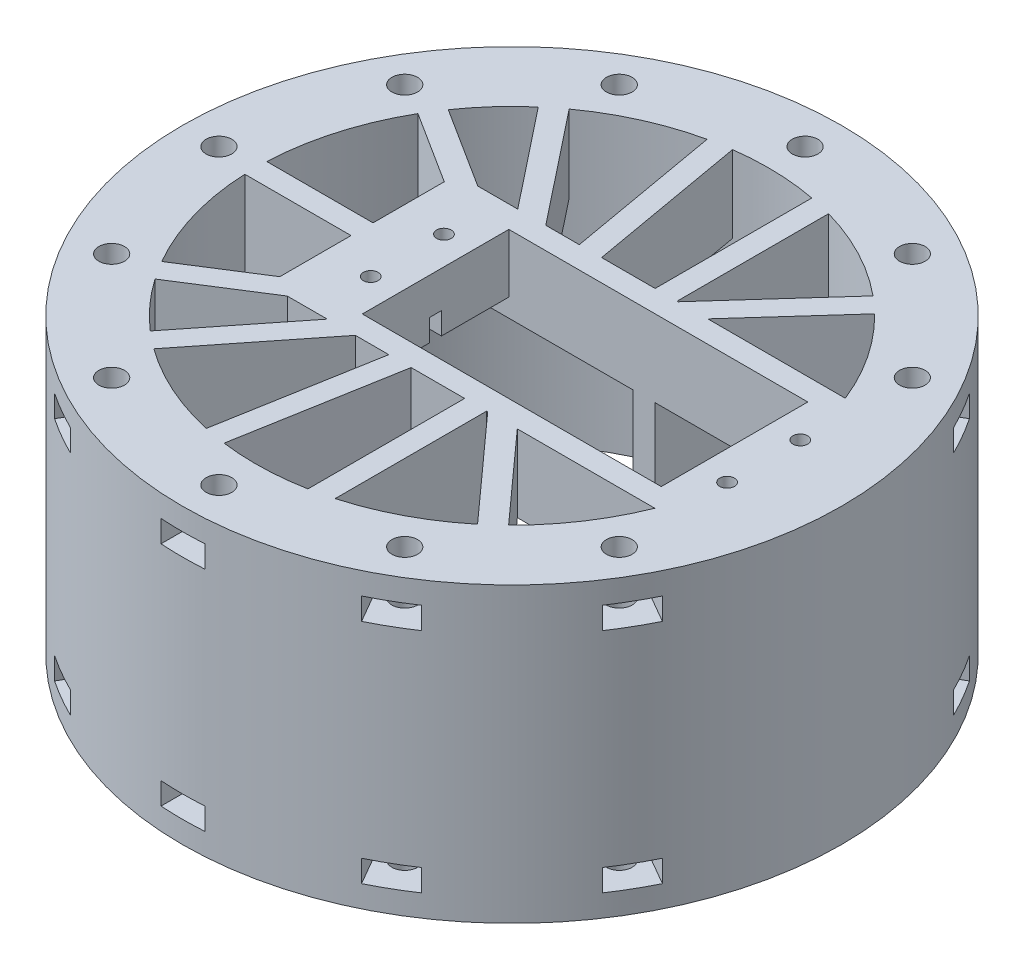
from build123d import *
from build123d.topology import SkipClean

# Parameters (mm, degrees)
SKETCH1_R                      = 45
BOSS_EXTRUDE1_DEPTH            = 40
SKETCH2_R                      = 35
CUT_EXTRUDE1_DEPTH             = 29.5
SKETCH3_W                      = 55
SKETCH3_H                      = 20
CUT_EXTRUDE2_DEPTH             = 2.5
CUT_EXTRUDE2_DIRECTION_2_REACH = 72.144
SKETCH4_W                      = 40.8
SKETCH4_H                      = 20
CUT_EXTRUDE3_DEPTH             = 9
BOSS_EXTRUDE2_DEPTH            = 29.5
SKETCH16_W                     = 7.160198966
SKETCH16_H                     = 1.6
SKETCH16_W_2                   = 7.039801034
CUT_EXTRUDE10_DEPTH            = 3
SKETCH27_R                     = 1.75
CUT_EXTRUDE15_DEPTH            = 76.166481892
CUT_EXTRUDE17_START            = -3
CUT_EXTRUDE17_DEPTH            = 3
SKETCH32_R                     = 1
CUT_EXTRUDE21_DEPTH            = 72.232015274
CUT_EXTRUDE22_DEPTH            = 12
CUT_EXTRUDE23_REACH            = 78.074
CUT_EXTRUDE24_DEPTH            = 3


with BuildPart() as part:
    # Sketch1 → Boss-Extrude1 (new body)
    with BuildSketch(Plane(origin=(0, 0, 0), x_dir=(1, 0, 0), z_dir=(0, 1, 0))):
        with Locations(Location((0, 0, 0), (0, 0, 270))):
            Circle(SKETCH1_R)
    extrude(amount=BOSS_EXTRUDE1_DEPTH)

    # Sketch2 → Cut-Extrude1 (cut)
    with BuildSketch(Plane.XZ):
        with Locations(Location((0, 0, 0), (0, 0, 270))):
            Circle(SKETCH2_R)
    extrude(amount=-CUT_EXTRUDE1_DEPTH, mode=Mode.SUBTRACT)

    # Sketch3 → Cut-Extrude2 (cut)
    with BuildSketch(Plane.XZ.offset(-29.5)):
        with Locations((10.032407403, 0)):
            Rectangle(SKETCH3_W, SKETCH3_H)
    extrude(amount=-CUT_EXTRUDE2_DEPTH, mode=Mode.SUBTRACT)

    # Sketch3 → Cut-Extrude2 direction 2 (cut, up to next)
    with BuildSketch(Plane.XZ.offset(-29.5), mode=Mode.PRIVATE) as cut_extrude2_direction_2_sk1:
        with Locations((10.032407403, 0)):
            Rectangle(SKETCH3_W, SKETCH3_H)
    cut_extrude2_direction_2_tool1 = extrude(cut_extrude2_direction_2_sk1.sketch, amount=CUT_EXTRUDE2_DIRECTION_2_REACH, mode=Mode.PRIVATE) & part.part
    add(cut_extrude2_direction_2_tool1.solids().sort_by_distance((10.032407, 29.5, 0))[0], mode=Mode.SUBTRACT)

    # Sketch4 → Cut-Extrude3 (cut)
    with BuildSketch(Plane.XZ.offset(-32)):
        with Locations((9.972208437, 0)):
            Rectangle(SKETCH4_W, SKETCH4_H)
    extrude(amount=-CUT_EXTRUDE3_DEPTH, mode=Mode.SUBTRACT)

    # Sketch8 → Boss-Extrude2 (add, through all)
    with BuildSketch(Plane.XZ.offset(-29.5)):
        with BuildLine():
            Line((6.536713533, 10), (6.536713533, 34.384173339))
            ThreePointArc((6.536713533, 34.384173339), (8.317046002, 35.216938381), (9.536713533, 33.675675123))
            Line((9.536713533, 33.675675123), (9.536713533, 10))
            Line((9.536713533, 10), (6.536713533, 10))
        make_face()
        with BuildLine():
            Line((9.536713533, -10), (6.536713533, -10))
            Line((6.536713533, -10), (6.536713533, -34.384173339))
            ThreePointArc((6.536713533, -34.384173339), (8.317046002, -35.216938381), (9.536713533, -33.675675123))
            Line((9.536713533, -33.675675123), (9.536713533, -10))
        make_face()
        with BuildLine():
            Line((-17.467592597, 1.5), (-34.96784237, 1.5))
            ThreePointArc((-34.96784237, 1.5), (-36.46784237, 0), (-34.96784237, -1.5))
            Line((-34.96784237, -1.5), (-17.467592597, -1.5))
            Line((-17.467592597, -1.5), (-17.467592597, 1.5))
        make_face()
    extrude(amount=BOSS_EXTRUDE2_DEPTH)

    # Sketch16 → Cut-Extrude10 (cut)
    with BuildSketch(Plane.XZ.offset(-32)):
        with Locations((33.95230792, 0)):
            Rectangle(SKETCH16_W, SKETCH16_H)
        with Locations((-13.94769208, 0)):
            Rectangle(SKETCH16_W_2, SKETCH16_H)
    extrude(amount=-CUT_EXTRUDE10_DEPTH, mode=Mode.SUBTRACT)

    # Sketch27 → Cut-Extrude15 (cut, through all)
    with BuildSketch(Plane.XZ):
        with Locations(Location((34.641016151, -20, 0), (0, 0, 270))):
            Circle(SKETCH27_R)
        with Locations(Location((20, -34.641016151, 0), (0, 0, 270))):
            Circle(SKETCH27_R)
        with Locations(Location((0, -40, 0), (0, 0, 270))):
            Circle(SKETCH27_R)
        with Locations(Location((-20, -34.641016151, 0), (0, 0, 270))):
            Circle(SKETCH27_R)
        with Locations(Location((-34.641016151, -20, 0), (0, 0, 270))):
            Circle(SKETCH27_R)
        with Locations(Location((-40, 0, 0), (0, 0, 270))):
            Circle(SKETCH27_R)
        with Locations(Location((-34.641016151, 20, 0), (0, 0, 270))):
            Circle(SKETCH27_R)
        with Locations(Location((-20, 34.641016151, 0), (0, 0, 270))):
            Circle(SKETCH27_R)
        with Locations(Location((0, 40, 0), (0, 0, 270))):
            Circle(SKETCH27_R)
        with Locations(Location((20, 34.641016151, 0), (0, 0, 270))):
            Circle(SKETCH27_R)
        with Locations(Location((34.641016151, 20, 0), (0, 0, 270))):
            Circle(SKETCH27_R)
    extrude(amount=-CUT_EXTRUDE15_DEPTH, mode=Mode.SUBTRACT)

    # Sketch28 → Cut-Extrude17 (cut)
    with BuildSketch(Plane(origin=(0, 37, 0), x_dir=(1, 0, 0), z_dir=(0, 1, 0)).offset(CUT_EXTRUDE17_START)):
        with BuildLine():
            Line((-31.641016151, 18.267949192), (-31.641016151, 21.732050808))
            Line((-31.641016151, 21.732050808), (-37.38444419, 25.048020532))
            ThreePointArc((-37.38444419, 25.048020532), (-38.97114317, 22.5), (-40.38444419, 19.851868109))
            Line((-40.38444419, 19.851868109), (-34.641016151, 16.535898385))
            Line((-34.641016151, 16.535898385), (-31.641016151, 18.267949192))
        make_face()
        with BuildLine():
            Line((-36.535898385, 0), (-38.267949192, 3))
            Line((-38.267949192, 3), (-44.899888641, 3))
            ThreePointArc((-44.899888641, 3), (-45, 0), (-44.899888641, -3))
            Line((-44.899888641, -3), (-38.267949192, -3))
            Line((-38.267949192, -3), (-36.535898385, 0))
        make_face()
        with BuildLine():
            Line((-18.267949192, 31.641016151), (-16.535898385, 34.641016151))
            Line((-16.535898385, 34.641016151), (-19.851868109, 40.38444419))
            ThreePointArc((-19.851868109, 40.38444419), (-22.5, 38.97114317), (-25.048020532, 37.38444419))
            Line((-25.048020532, 37.38444419), (-21.732050808, 31.641016151))
            Line((-21.732050808, 31.641016151), (-18.267949192, 31.641016151))
        make_face()
        with BuildLine():
            Line((0, 36.535898385), (3, 38.267949192))
            Line((3, 38.267949192), (3, 44.899888641))
            ThreePointArc((3, 44.899888641), (0, 45), (-3, 44.899888641))
            Line((-3, 44.899888641), (-3, 38.267949192))
            Line((-3, 38.267949192), (0, 36.535898385))
        make_face()
        with BuildLine():
            Line((18.267949192, 31.641016151), (21.732050808, 31.641016151))
            Line((21.732050808, 31.641016151), (25.048020532, 37.38444419))
            ThreePointArc((25.048020532, 37.38444419), (22.5, 38.97114317), (19.851868109, 40.38444419))
            Line((19.851868109, 40.38444419), (16.535898385, 34.641016151))
            Line((16.535898385, 34.641016151), (18.267949192, 31.641016151))
        make_face()
        with BuildLine():
            Line((31.641016151, 18.267949192), (34.641016151, 16.535898385))
            Line((34.641016151, 16.535898385), (40.38444419, 19.851868109))
            ThreePointArc((40.38444419, 19.851868109), (38.97114317, 22.5), (37.38444419, 25.048020532))
            Line((37.38444419, 25.048020532), (31.641016151, 21.732050808))
            Line((31.641016151, 21.732050808), (31.641016151, 18.267949192))
        make_face()
        with BuildLine():
            Line((31.641016151, -18.267949192), (31.641016151, -21.732050808))
            Line((31.641016151, -21.732050808), (37.38444419, -25.048020532))
            ThreePointArc((37.38444419, -25.048020532), (38.97114317, -22.5), (40.38444419, -19.851868109))
            Line((40.38444419, -19.851868109), (34.641016151, -16.535898385))
            Line((34.641016151, -16.535898385), (31.641016151, -18.267949192))
        make_face()
        with BuildLine():
            Line((18.267949192, -31.641016151), (16.535898385, -34.641016151))
            Line((16.535898385, -34.641016151), (19.851868109, -40.38444419))
            ThreePointArc((19.851868109, -40.38444419), (22.5, -38.97114317), (25.048020532, -37.38444419))
            Line((25.048020532, -37.38444419), (21.732050808, -31.641016151))
            Line((21.732050808, -31.641016151), (18.267949192, -31.641016151))
        make_face()
        with BuildLine():
            Line((0, -36.535898385), (-3, -38.267949192))
            Line((-3, -38.267949192), (-3, -44.899888641))
            ThreePointArc((-3, -44.899888641), (0, -45), (3, -44.899888641))
            Line((3, -44.899888641), (3, -38.267949192))
            Line((3, -38.267949192), (0, -36.535898385))
        make_face()
        with BuildLine():
            Line((-18.267949192, -31.641016151), (-21.732050808, -31.641016151))
            Line((-21.732050808, -31.641016151), (-25.048020532, -37.38444419))
            ThreePointArc((-25.048020532, -37.38444419), (-22.5, -38.97114317), (-19.851868109, -40.38444419))
            Line((-19.851868109, -40.38444419), (-16.535898385, -34.641016151))
            Line((-16.535898385, -34.641016151), (-18.267949192, -31.641016151))
        make_face()
        with BuildLine():
            Line((-31.641016151, -18.267949192), (-34.641016151, -16.535898385))
            Line((-34.641016151, -16.535898385), (-40.38444419, -19.851868109))
            ThreePointArc((-40.38444419, -19.851868109), (-38.97114317, -22.5), (-37.38444419, -25.048020532))
            Line((-37.38444419, -25.048020532), (-31.641016151, -21.732050808))
            Line((-31.641016151, -21.732050808), (-31.641016151, -18.267949192))
        make_face()
    extrude(amount=CUT_EXTRUDE17_DEPTH, mode=Mode.SUBTRACT)

    # Sketch32 → Cut-Extrude21 (cut, through all)
    with BuildSketch(Plane.XZ.offset(-32)):
        with Locations(Location((-14.287592597, -5, 0), (0, 0, 270))):
            Circle(SKETCH32_R)
        with Locations(Location((-14.287592597, 5, 0), (0, 0, 90))):
            Circle(SKETCH32_R)
        with Locations(Location((34.352407403, -5, 0), (0, 0, 90))):
            Circle(SKETCH32_R)
        with Locations(Location((34.352407403, 5, 0), (0, 0, 270))):
            Circle(SKETCH32_R)
    extrude(amount=-CUT_EXTRUDE21_DEPTH, mode=Mode.SUBTRACT)

    # Sketch29 → Cut-Extrude22 (cut)
    with BuildSketch(Plane.XZ.offset(-29.5)):
        with BuildLine():
            Line((-20.467592597, 11.223012065), (-30.32145066, 17.481694136))
            ThreePointArc((-30.32145066, 17.481694136), (-33.608430236, 9.771049946), (-34.96784237, 1.5))
            Line((-34.96784237, 1.5), (-20.467592597, 1.5))
            Line((-20.467592597, 1.5), (-20.467592597, 11.223012065))
        make_face()
        with BuildLine():
            ThreePointArc((-34.96784237, -1.5), (-33.608430236, -9.771049946), (-30.32145066, -17.481694136))
            Line((-30.32145066, -17.481694136), (-20.467592597, -11.223012065))
            Line((-20.467592597, -11.223012065), (-20.467592597, -1.5))
            Line((-20.467592597, -1.5), (-34.96784237, -1.5))
        make_face()
        with BuildLine():
            ThreePointArc((-28.713011556, -20.014069236), (-26.003567366, -23.426789883), (-22.891062575, -26.476390506))
            Line((-22.891062575, -26.476390506), (-12.21368146, -13))
            Line((-12.21368146, -13), (-17.669849128, -13))
            Line((-17.669849128, -13), (-28.713011556, -20.014069236))
        make_face()
        with BuildLine():
            ThreePointArc((-20.539653162, -28.339418625), (-14.344487277, -31.925470784), (-7.549313734, -34.176130005))
            Line((-7.549313734, -34.176130005), (-3.815390667, -13))
            Line((-3.815390667, -13), (-8.386189764, -13))
            Line((-8.386189764, -13), (-20.539653162, -28.339418625))
        make_face()
        with BuildLine():
            Line((6.536713533, -34.384173339), (6.536713533, -13))
            Line((6.536713533, -13), (-0.769110831, -13))
            Line((-0.769110831, -13), (-4.594890475, -34.697074538))
            ThreePointArc((-4.594890475, -34.697074538), (0.983435807, -34.986180901), (6.536713533, -34.384173339))
        make_face()
        with BuildLine():
            Line((9.536713533, -13), (9.536713533, -33.675675123))
            ThreePointArc((9.536713533, -33.675675123), (16.258507894, -30.994530502), (22.285220439, -26.988311359))
            Line((22.285220439, -26.988311359), (9.688319988, -13))
            Line((9.688319988, -13), (9.536713533, -13))
        make_face()
        with BuildLine():
            Line((13.725471951, -13), (24.514514774, -24.980763908))
            ThreePointArc((24.514514774, -24.980763908), (29.127972013, -19.40518607), (32.496153619, -13))
            Line((32.496153619, -13), (13.725471951, -13))
        make_face()
        with BuildLine():
            Line((32.496153619, 13), (13.725471951, 13))
            Line((13.725471951, 13), (24.514514774, 24.980763908))
            ThreePointArc((24.514514774, 24.980763908), (29.127972013, 19.40518607), (32.496153619, 13))
        make_face()
        with BuildLine():
            Line((9.688319988, 13), (22.285220439, 26.988311359))
            ThreePointArc((22.285220439, 26.988311359), (16.258507894, 30.994530502), (9.536713533, 33.675675123))
            Line((9.536713533, 33.675675123), (9.536713533, 13))
            Line((9.536713533, 13), (9.688319988, 13))
        make_face()
        with BuildLine():
            Line((6.536713533, 13), (6.536713533, 34.384173339))
            ThreePointArc((6.536713533, 34.384173339), (0.983435807, 34.986180901), (-4.594890475, 34.697074538))
            Line((-4.594890475, 34.697074538), (-0.769110831, 13))
            Line((-0.769110831, 13), (6.536713533, 13))
        make_face()
        with BuildLine():
            Line((-7.549313734, 34.176130005), (-3.815390667, 13))
            Line((-3.815390667, 13), (-8.386189764, 13))
            Line((-8.386189764, 13), (-20.539653162, 28.339418625))
            ThreePointArc((-20.539653162, 28.339418625), (-14.344487277, 31.925470784), (-7.549313734, 34.176130005))
        make_face()
        with BuildLine():
            Line((-22.891062575, 26.476390506), (-12.21368146, 13))
            Line((-12.21368146, 13), (-17.669849128, 13))
            Line((-17.669849128, 13), (-28.713011556, 20.014069236))
            ThreePointArc((-28.713011556, 20.014069236), (-26.003567366, 23.426789883), (-22.891062575, 26.476390506))
        make_face()
    extrude(amount=-CUT_EXTRUDE22_DEPTH, mode=Mode.SUBTRACT)

    # Sketch33 → Cut-Extrude23 (cut, up to next)
    with BuildSketch(Plane.XY.offset(1.5), mode=Mode.PRIVATE) as cut_extrude23_sk1:
        Polygon((-17.467592597, 14.75), (-34.96784237, 0), (-17.467592597, 0), align=None)
    cut_extrude23_tool1 = extrude(cut_extrude23_sk1.sketch, amount=-CUT_EXTRUDE23_REACH, mode=Mode.PRIVATE) & part.part
    add(cut_extrude23_tool1.solids().sort_by_distance((-23.301009, 4.916667, 1.5))[0], mode=Mode.SUBTRACT)

    # Sketch34 → Cut-Extrude24 (cut)
    with SkipClean():  # the faces are left unmerged after this step: merging them gives an invalid solid
        with BuildSketch(Plane(origin=(0, 3, 0), x_dir=(-1, 0, 0), z_dir=(0, -1, 0))):
            with BuildLine():
                Line((18.267949192, 31.641016151), (21.732050808, 31.641016151))
                Line((21.732050808, 31.641016151), (25.048020532, 37.38444419))
                ThreePointArc((25.048020532, 37.38444419), (22.5, 38.97114317), (19.851868109, 40.38444419))
                Line((19.851868109, 40.38444419), (16.535898385, 34.641016151))
                Line((16.535898385, 34.641016151), (18.267949192, 31.641016151))
            make_face()
            with BuildLine():
                Line((0, 36.535898385), (3, 38.267949192))
                Line((3, 38.267949192), (3, 44.899888641))
                ThreePointArc((3, 44.899888641), (0, 45), (-3, 44.899888641))
                Line((-3, 44.899888641), (-3, 38.267949192))
                Line((-3, 38.267949192), (0, 36.535898385))
            make_face()
            with BuildLine():
                Line((31.641016151, 18.267949192), (34.641016151, 16.535898385))
                Line((34.641016151, 16.535898385), (40.38444419, 19.851868109))
                ThreePointArc((40.38444419, 19.851868109), (38.97114317, 22.5), (37.38444419, 25.048020532))
                Line((37.38444419, 25.048020532), (31.641016151, 21.732050808))
                Line((31.641016151, 21.732050808), (31.641016151, 18.267949192))
            make_face()
            with BuildLine():
                Line((36.535898385, 0), (38.267949192, -3))
                Line((38.267949192, -3), (44.899888641, -3))
                ThreePointArc((44.899888641, -3), (45, 0), (44.899888641, 3))
                Line((44.899888641, 3), (38.267949192, 3))
                Line((38.267949192, 3), (36.535898385, 0))
            make_face()
            with BuildLine():
                Line((31.641016151, -18.267949192), (31.641016151, -21.732050808))
                Line((31.641016151, -21.732050808), (37.38444419, -25.048020532))
                ThreePointArc((37.38444419, -25.048020532), (38.97114317, -22.5), (40.38444419, -19.851868109))
                Line((40.38444419, -19.851868109), (34.641016151, -16.535898385))
                Line((34.641016151, -16.535898385), (31.641016151, -18.267949192))
            make_face()
            with BuildLine():
                Line((18.267949192, -31.641016151), (16.535898385, -34.641016151))
                Line((16.535898385, -34.641016151), (19.851868109, -40.38444419))
                ThreePointArc((19.851868109, -40.38444419), (22.5, -38.97114317), (25.048020532, -37.38444419))
                Line((25.048020532, -37.38444419), (21.732050808, -31.641016151))
                Line((21.732050808, -31.641016151), (18.267949192, -31.641016151))
            make_face()
            with BuildLine():
                Line((0, -36.535898385), (-3, -38.267949192))
                Line((-3, -38.267949192), (-3, -44.899888641))
                ThreePointArc((-3, -44.899888641), (0, -45), (3, -44.899888641))
                Line((3, -44.899888641), (3, -38.267949192))
                Line((3, -38.267949192), (0, -36.535898385))
            make_face()
            with BuildLine():
                Line((-18.267949192, -31.641016151), (-21.732050808, -31.641016151))
                Line((-21.732050808, -31.641016151), (-25.048020532, -37.38444419))
                ThreePointArc((-25.048020532, -37.38444419), (-22.5, -38.97114317), (-19.851868109, -40.38444419))
                Line((-19.851868109, -40.38444419), (-16.535898385, -34.641016151))
                Line((-16.535898385, -34.641016151), (-18.267949192, -31.641016151))
            make_face()
            with BuildLine():
                Line((-31.641016151, -18.267949192), (-34.641016151, -16.535898385))
                Line((-34.641016151, -16.535898385), (-40.38444419, -19.851868109))
                ThreePointArc((-40.38444419, -19.851868109), (-38.97114317, -22.5), (-37.38444419, -25.048020532))
                Line((-37.38444419, -25.048020532), (-31.641016151, -21.732050808))
                Line((-31.641016151, -21.732050808), (-31.641016151, -18.267949192))
            make_face()
            with BuildLine():
                Line((-31.641016151, 18.267949192), (-31.641016151, 21.732050808))
                Line((-31.641016151, 21.732050808), (-37.38444419, 25.048020532))
                ThreePointArc((-37.38444419, 25.048020532), (-38.97114317, 22.5), (-40.38444419, 19.851868109))
                Line((-40.38444419, 19.851868109), (-34.641016151, 16.535898385))
                Line((-34.641016151, 16.535898385), (-31.641016151, 18.267949192))
            make_face()
            with BuildLine():
                Line((-18.267949192, 31.641016151), (-16.535898385, 34.641016151))
                Line((-16.535898385, 34.641016151), (-19.851868109, 40.38444419))
                ThreePointArc((-19.851868109, 40.38444419), (-22.5, 38.97114317), (-25.048020532, 37.38444419))
                Line((-25.048020532, 37.38444419), (-21.732050808, 31.641016151))
                Line((-21.732050808, 31.641016151), (-18.267949192, 31.641016151))
            make_face()
        extrude(amount=-CUT_EXTRUDE24_DEPTH, mode=Mode.SUBTRACT)


solid = part.part
